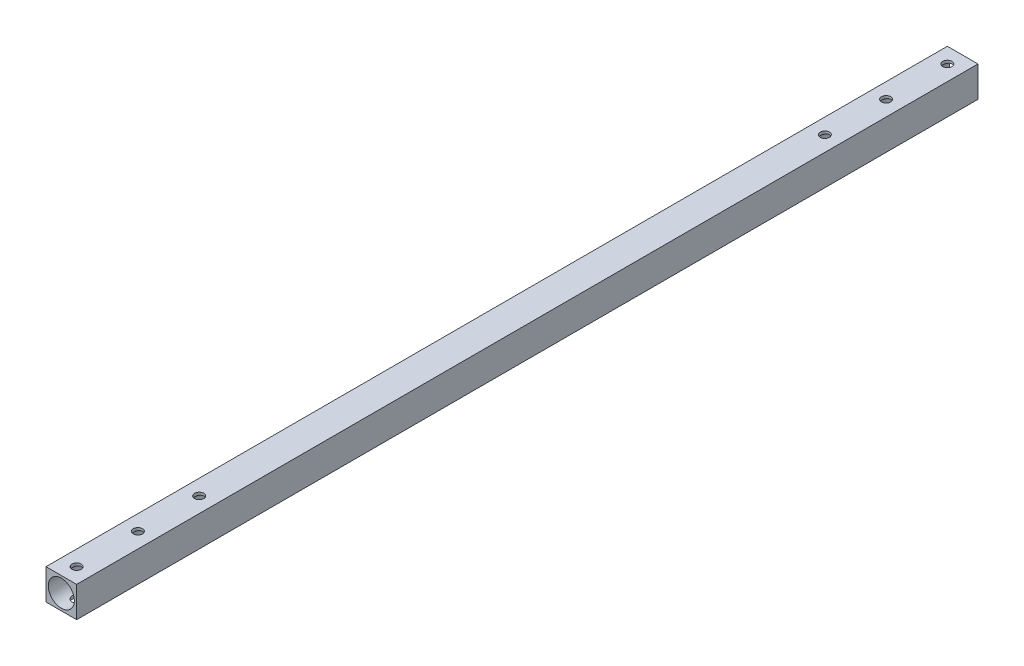
from build123d import *

# Parameters (mm, degrees)
SKETCH1_W           = 10
SKETCH1_H           = 10
SKETCH1_R           = 4.25
BOSS_EXTRUDE1_DEPTH = 294.2
SKETCH2_R           = 1.5
CUT_EXTRUDE1_DEPTH  = 295.412363871


with BuildPart() as part:
    # Sketch1 → Boss-Extrude1 (new body)
    with BuildSketch(Plane.XY):
        Rectangle(SKETCH1_W, SKETCH1_H)
        Circle(SKETCH1_R, mode=Mode.SUBTRACT)
    extrude(amount=BOSS_EXTRUDE1_DEPTH)

    # Sketch2 → Cut-Extrude1 (cut, through all)
    with BuildSketch(Plane(origin=(0, 5, 0), x_dir=(1, 0, 0), z_dir=(0, 1, 0))):
        with Locations(Location((0, -5, 0), (0, 0, 270))):
            Circle(SKETCH2_R)
        with Locations(Location((0, -25, 0), (0, 0, 270))):
            Circle(SKETCH2_R)
        with Locations(Location((0, -45, 0), (0, 0, 270))):
            Circle(SKETCH2_R)
        with Locations(Location((0, -289.2, 0), (0, 0, 270))):
            Circle(SKETCH2_R)
        with Locations(Location((0, -269.2, 0), (0, 0, 270))):
            Circle(SKETCH2_R)
        with Locations(Location((0, -249.2, 0), (0, 0, 270))):
            Circle(SKETCH2_R)
    extrude(amount=-CUT_EXTRUDE1_DEPTH, mode=Mode.SUBTRACT)


solid = part.part
